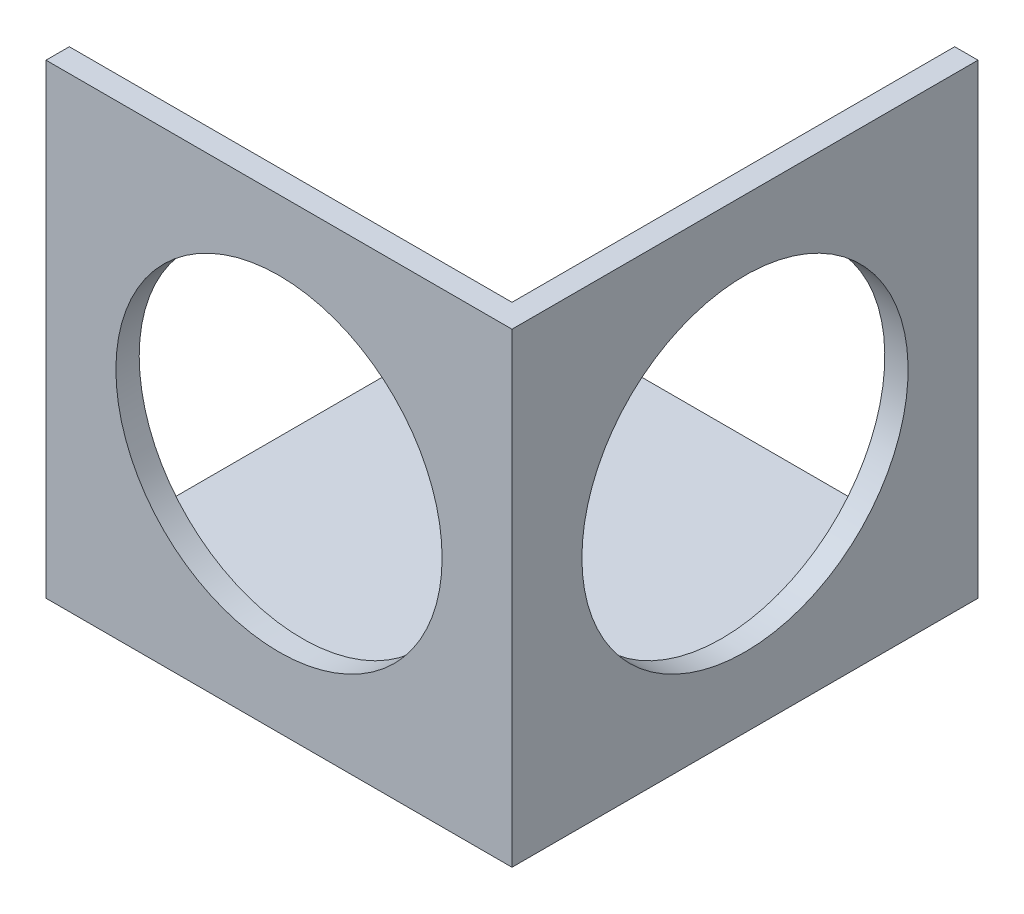
from build123d import *

# Parameters (mm, degrees)
ESQUISSE4_W             = 100
ESQUISSE4_H             = 100
ESQUISSE4_W_2           = 90
ESQUISSE4_H_2           = 90
BOSS_EXTRU_1_DEPTH      = 100
ESQUISSE5_W             = 100
ESQUISSE5_H             = 100
BOSS_EXTRU_2_DEPTH      = 10
ESQUISSE6_W             = 95
ESQUISSE6_H             = 94.999780415
ENL_V_MAT_EXTRU_1_DEPTH = 95
ESQUISSE7_W             = 95
ESQUISSE7_H             = 95
ENL_V_MAT_EXTRU_2_DEPTH = 1
ESQUISSE8_W             = 95
ESQUISSE8_H             = 95
BOSS_EXTRU_3_DEPTH      = 1
ENL_V_MAT_EXTRU_4_DEPTH = 55.5
ENL_V_MAT_EXTRU_5_DEPTH = 21.5


with BuildPart() as part:
    # Esquisse4 → Boss.-Extru.1 (new body)
    with BuildSketch(Plane.XY):
        with Locations((1.564199822, -3.801871506)):
            Rectangle(ESQUISSE4_W, ESQUISSE4_H)
        with Locations((1.564199822, -3.801871506)):
            Rectangle(ESQUISSE4_W_2, ESQUISSE4_H_2, mode=Mode.SUBTRACT)
    extrude(amount=BOSS_EXTRU_1_DEPTH)

    # Esquisse5 → Boss.-Extru.2 (add)
    with BuildSketch(Plane.XY.offset(100)):
        with Locations((1.564199822, -3.801871506)):
            Rectangle(ESQUISSE5_W, ESQUISSE5_H)
    extrude(amount=-BOSS_EXTRU_2_DEPTH)

    # Esquisse6 → Enlèv. mat.-Extru.1 (cut)
    with BuildSketch(Plane(origin=(0, 0, 0), x_dir=(-1, 0, 0), z_dir=(0, 0, -1))):
        with Locations((0.935800178, -1.301761713)):
            Rectangle(ESQUISSE6_W, ESQUISSE6_H)
    extrude(amount=-ENL_V_MAT_EXTRU_1_DEPTH, mode=Mode.SUBTRACT)

    # Esquisse7 → Enlèv. mat.-Extru.2 (cut)
    with BuildSketch(Plane(origin=(0, -48.801651921, 0), x_dir=(1, 0, 0), z_dir=(0, 1, 0))):
        with Locations((-0.935800178, -47.5)):
            Rectangle(ESQUISSE7_W, ESQUISSE7_H)
    extrude(amount=-ENL_V_MAT_EXTRU_2_DEPTH, mode=Mode.SUBTRACT)

    # Esquisse8 → Boss.-Extru.3 (add)
    with BuildSketch(Plane(origin=(0, -49.801651921, 0), x_dir=(1, 0, 0), z_dir=(0, 1, 0))):
        with Locations((-0.935800178, -47.5)):
            Rectangle(ESQUISSE8_W, ESQUISSE8_H)
    extrude(amount=BOSS_EXTRU_3_DEPTH)

    # Esquisse9 → Enlèv. mat.-Extru.4 (cut)
    with BuildSketch(Plane(origin=(0, 0, 95), x_dir=(-1, 0, 0), z_dir=(0, 0, -1))):
        with BuildLine():
            ThreePointArc((23.184567711, 20.946945437), (-26.312906972, 20.94700582), (-26.312967355, -28.550468863))
            Line((-26.312967355, -28.550468863), (23.184567711, 20.946945437))
        make_face()
        with BuildLine():
            Line((23.184567711, 20.946945437), (-26.312967355, -28.550468863))
            ThreePointArc((-26.312967355, -28.550468863), (11.829700587, -36.137553521), (33.435800178, -3.801761713))
            ThreePointArc((33.435800178, -3.801761713), (30.771591985, 9.592138696), (23.184567711, 20.946945437))
        make_face()
    extrude(amount=-ENL_V_MAT_EXTRU_4_DEPTH, mode=Mode.SUBTRACT)

    # Esquisse11 → Enlèv. mat.-Extru.5 (cut)
    with BuildSketch(Plane.ZY.offset(-46.564199822)):
        with BuildLine():
            ThreePointArc((25.251232467, 20.946945437), (25.25129285, -28.550529246), (74.748767533, -28.550468863))
            Line((74.748767533, -28.550468863), (25.251232467, 20.946945437))
        make_face()
        with BuildLine():
            Line((25.251232467, 20.946945437), (74.748767533, -28.550468863))
            ThreePointArc((74.748767533, -28.550468863), (82.335791808, -17.195662123), (85, -3.801761713))
            ThreePointArc((85, -3.801761713), (63.393900409, 28.534030094), (25.251232467, 20.946945437))
        make_face()
    extrude(amount=-ENL_V_MAT_EXTRU_5_DEPTH, mode=Mode.SUBTRACT)


solid = part.part
